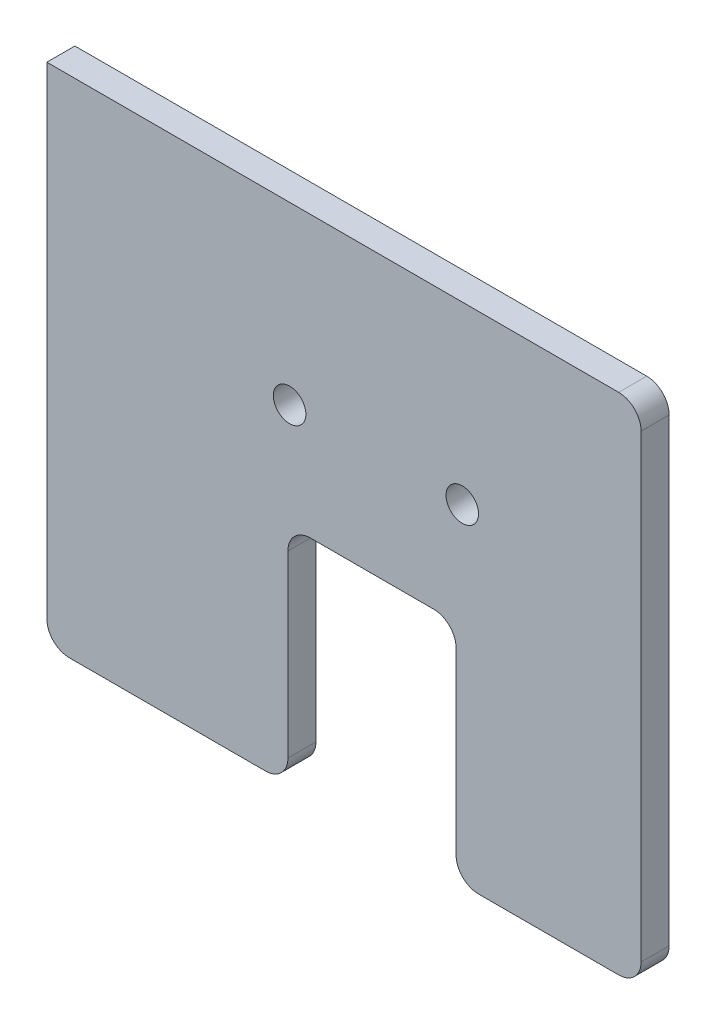
from build123d import *

# Parameters (mm, degrees)
SALIENTE_EXTRUIR1_DEPTH = 2.5
CROQUIS2_R              = 1.45
CORTAR_EXTRUIR1_DEPTH   = 2.5
REDONDEO1_R             = 2


with BuildPart() as part:
    # Croquis1 → Saliente-Extruir1 (new body)
    with BuildSketch(Plane.XY):
        Polygon((0, 0), (0, 45), (53, 45), (53, 0), (36.5, 0), (36.5, 20), (21.5, 20), (21.5, 0), align=None)
    extrude(amount=SALIENTE_EXTRUIR1_DEPTH)

    # Croquis2 → Cortar-Extruir1 (cut)
    with BuildSketch(Plane.XY.offset(2.5)):
        with Locations((37.05, 29.354509915)):
            Circle(CROQUIS2_R)
        with Locations((21.65, 29.354509915)):
            Circle(CROQUIS2_R)
    extrude(amount=-CORTAR_EXTRUIR1_DEPTH, mode=Mode.SUBTRACT)

    # Redondeo1
    redondeo1_edges = [part.edges().sort_by_distance(p)[0] for p in [
        (0, 0, 1.25),
        (53, 45, 1.25),
        (53, 0, 1.25),
        (36.5, 0, 1.25),
        (36.5, 20, 1.25),
        (21.5, 20, 1.25),
        (21.5, 0, 1.25),
    ]]
    fillet(redondeo1_edges, radius=REDONDEO1_R)


solid = part.part
